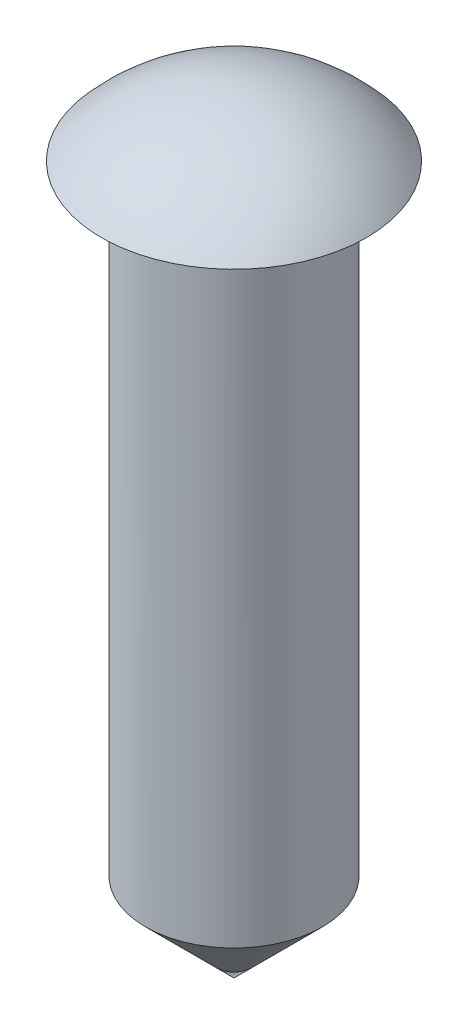
from build123d import *


with BuildPart() as part:
    # Sketch1 → Revolve1 (revolve)
    with BuildSketch(Plane.XY, mode=Mode.PRIVATE) as revolve1_sk:
        with BuildLine():
            Line((-1.5, -1.015686517), (-1.5, -11.515686517))
            Line((-1.5, -11.515686517), (0, -13.015686517))
            Line((0, -13.015686517), (0, 0))
            ThreePointArc((0, 0), (-1.234313483, -0.265686517), (-2.25, -1.015686517))
            Line((-2.25, -1.015686517), (-1.5, -1.015686517))
        make_face()
    revolve(revolve1_sk.sketch.rotate(Axis((0, -13.015686517, 0), (0, 1, 0)), 180), axis=Axis((0, -13.015686517, 0), (0, 1, 0)))


solid = part.part
